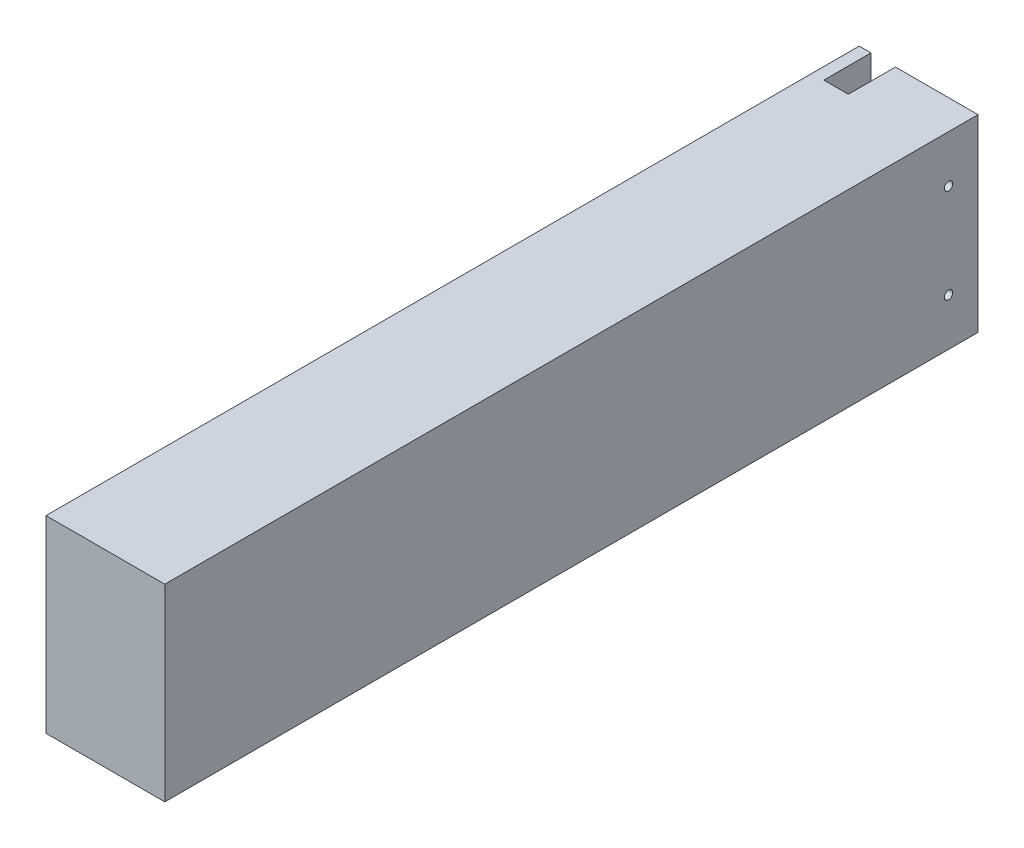
from build123d import *

# Parameters (mm, degrees)
BOSS_EXTRUDE1_DEPTH        = 50.8
SKETCH5_W                  = 15.875
SKETCH5_H                  = 50.8
BOSS_EXTRUDE2_DEPTH        = 19.05
F_4_40_TAPPED_HOLE1_REACH  = 64.104
F_4_40_TAPPED_HOLE1_BORE_R = 1.1303
SKETCH9_W                  = 32.004
SKETCH9_H                  = 50.8
BOSS_EXTRUDE4_DEPTH        = 203.2


with BuildPart() as part:
    # Sketch2 → Boss-Extrude1 (new body)
    with BuildSketch(Plane(origin=(0, 0, 0), x_dir=(1, 0, 0), z_dir=(0, 1, 0))):
        Polygon((0, 0), (0, 15.875), (3.175, 15.875), (3.175, 3.175), (9.779, 3.175), (9.779, 15.875), (12.954, 15.875), (12.954, 0), align=None)
    extrude(amount=BOSS_EXTRUDE1_DEPTH)

    # Sketch5 → Boss-Extrude2 (add)
    with BuildSketch(Plane(origin=(12.954, 0, 0), x_dir=(0, 0, -1), z_dir=(1, 0, 0))):
        with Locations((7.9375, 25.4)):
            Rectangle(SKETCH5_W, SKETCH5_H)
    extrude(amount=BOSS_EXTRUDE2_DEPTH)

    # #4-40 Tapped Hole1 bore → #4-40 Tapped Hole1 (cut, up to next)
    with BuildSketch(Plane(origin=(32.004, 0, 0), x_dir=(0, 0, -1), z_dir=(1, 0, 0)), mode=Mode.PRIVATE) as f_4_40_tapped_hole1_sk1:
        with Locations((7.9375, 12.7)):
            Circle(F_4_40_TAPPED_HOLE1_BORE_R)
    f_4_40_tapped_hole1_tool1 = extrude(f_4_40_tapped_hole1_sk1.sketch, amount=-F_4_40_TAPPED_HOLE1_REACH, mode=Mode.PRIVATE) & part.part
    # #4-40 Tapped Hole1 bore → #4-40 Tapped Hole1 (cut, up to next)
    with BuildSketch(Plane(origin=(32.004, 0, 0), x_dir=(0, 0, -1), z_dir=(1, 0, 0)), mode=Mode.PRIVATE) as f_4_40_tapped_hole1_sk2:
        with Locations((7.9375, 38.1)):
            Circle(F_4_40_TAPPED_HOLE1_BORE_R)
    f_4_40_tapped_hole1_tool2 = extrude(f_4_40_tapped_hole1_sk2.sketch, amount=-F_4_40_TAPPED_HOLE1_REACH, mode=Mode.PRIVATE) & part.part
    add(f_4_40_tapped_hole1_tool1.solids().sort_by_distance((32.004, 12.7, -7.9375))[0], mode=Mode.SUBTRACT)
    add(f_4_40_tapped_hole1_tool2.solids().sort_by_distance((32.004, 38.1, -7.9375))[0], mode=Mode.SUBTRACT)

    # Sketch9 → Boss-Extrude4 (add)
    with BuildSketch(Plane.XY):
        with Locations((16.002, 25.4)):
            Rectangle(SKETCH9_W, SKETCH9_H)
    extrude(amount=BOSS_EXTRUDE4_DEPTH)


solid = part.part
